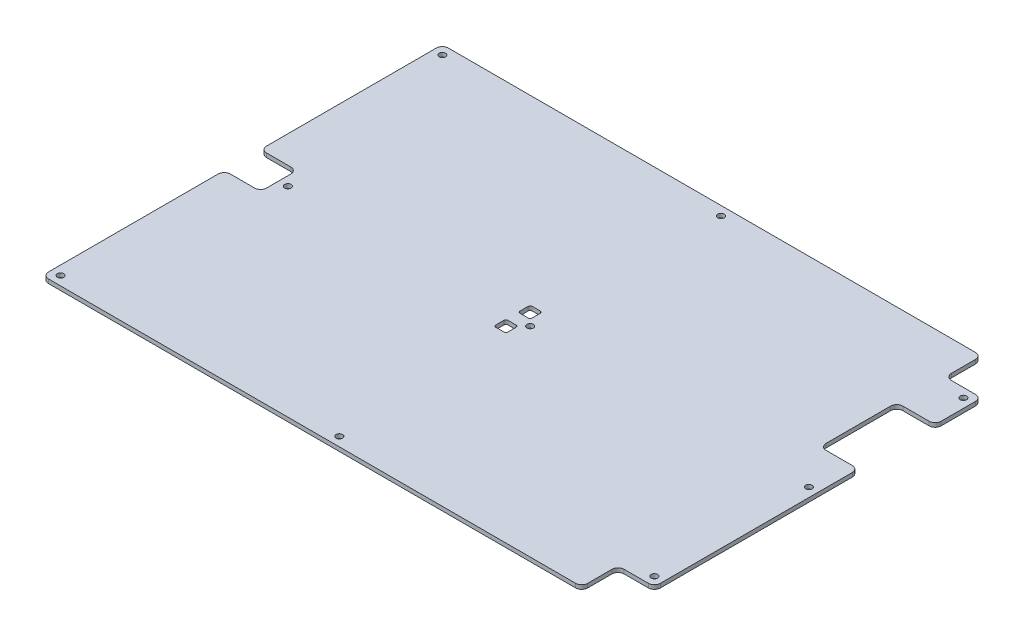
from build123d import *

# Parameters (mm, degrees)
CROQUIS1_R               = 1.6
SALIENTE_EXTRUIR1_DEPTH  = 2
REDONDEO1_R              = 3
CROQUIS3_W               = 19
CROQUIS3_H               = 38
SORTIDA_CABLE_LLIT_DEPTH = 348.03458041
REDONDEO3_R              = 3
CROQUIS4_W               = 6
CROQUIS4_H               = 6
FORAT_TERMISTOR_DEPTH    = 348.03458041
REDONDEO4_R              = 1


with BuildPart() as part:
    # Croquis1 → Saliente-Extruir1 (new body)
    with BuildSketch(Plane(origin=(0, 2, 0), x_dir=(1, 0, 0), z_dir=(0, 1, 0))):
        Polygon((0, 198), (0, 108), (18, 108), (18, 90), (0, 90), (0, 0), (267, 0), (267, 18), (285, 18), (285, 180), (267, 180), (267, 198), align=None)
        with Locations(Location((142.5, 193.5, 0), (0, 0, 270))):
            Circle(CROQUIS1_R, mode=Mode.SUBTRACT)
        with Locations(Location((4.5, 193.5, 0), (0, 0, 270))):
            Circle(CROQUIS1_R, mode=Mode.SUBTRACT)
        with Locations(Location((280.5, 22.5, 0), (0, 0, 90))):
            Circle(CROQUIS1_R, mode=Mode.SUBTRACT)
        with Locations(Location((280.5, 175.5, 0), (0, 0, 270))):
            Circle(CROQUIS1_R, mode=Mode.SUBTRACT)
        with Locations(Location((280.5, 99, 0), (0, 0, 270))):
            Circle(CROQUIS1_R, mode=Mode.SUBTRACT)
        with Locations(Location((142.5, 4.5, 0), (0, 0, 90))):
            Circle(CROQUIS1_R, mode=Mode.SUBTRACT)
        with Locations(Location((4.5, 4.5, 0), (0, 0, 90))):
            Circle(CROQUIS1_R, mode=Mode.SUBTRACT)
        with Locations(Location((142.5, 99, 0), (0, 0, 270))):
            Circle(CROQUIS1_R, mode=Mode.SUBTRACT)
        with Locations(Location((22.5, 99, 0), (0, 0, 270))):
            Circle(CROQUIS1_R, mode=Mode.SUBTRACT)
    extrude(amount=-SALIENTE_EXTRUIR1_DEPTH)

    # Redondeo1
    redondeo1_edges = [part.edges().sort_by_distance(p)[0] for p in [
        (267, 1, -198),
        (267, 1, -180),
        (285, 1, -180),
        (285, 1, -18),
        (267, 1, -18),
        (267, 1, 0),
        (0, 1, 0),
        (0, 1, -90),
        (18, 1, -90),
        (18, 1, -108),
        (0, 1, -108),
        (0, 1, -198),
    ]]
    fillet(redondeo1_edges, radius=REDONDEO1_R)

    # Croquis3 → Sortida cable llit (cut, through all)
    with BuildSketch(Plane(origin=(0, 2, 0), x_dir=(1, 0, 0), z_dir=(0, 1, 0))):
        with Locations((275.5, 138)):
            Rectangle(CROQUIS3_W, CROQUIS3_H)
    extrude(amount=-SORTIDA_CABLE_LLIT_DEPTH, mode=Mode.SUBTRACT)

    # Redondeo3
    redondeo3_edges = [part.edges().sort_by_distance(p)[0] for p in [
        (285, 1, -157),
        (285, 1, -119),
        (266, 1, -119),
        (266, 1, -157),
    ]]
    fillet(redondeo3_edges, radius=REDONDEO3_R)

    # Croquis4 → Forat termistor (cut, through all)
    with BuildSketch(Plane.XZ):
        with Locations((136.5, -93)):
            Rectangle(CROQUIS4_W, CROQUIS4_H)
        with Locations((136.5, -105)):
            Rectangle(CROQUIS4_W, CROQUIS4_H)
    extrude(amount=-FORAT_TERMISTOR_DEPTH, mode=Mode.SUBTRACT)

    # Redondeo4
    redondeo4_edges = [part.edges().sort_by_distance(p)[0] for p in [
        (133.5, 1, -96),
        (133.5, 1, -90),
        (139.5, 1, -90),
        (139.5, 1, -96),
        (139.5, 1, -108),
        (133.5, 1, -108),
        (133.5, 1, -102),
        (139.5, 1, -102),
    ]]
    fillet(redondeo4_edges, radius=REDONDEO4_R)


solid = part.part
